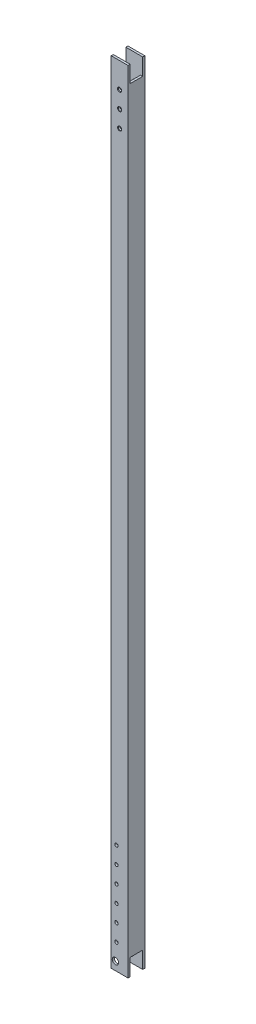
from build123d import *

# Parameters (mm, degrees)
SKETCH1_W                       = 25.4
SKETCH1_H                       = 25.4
SKETCH1_W_2                     = 19.05
SKETCH1_H_2                     = 19.05
BOSS_EXTRUDE1_DEPTH             = 1143
F_10_CLEARANCE_HOLE1_D          = 5.1054
F_10_CLEARANCE_HOLE2_AT_2_COUNT = 2
F_10_CLEARANCE_HOLE2_AT_2_PITCH = 50.8
F_10_CLEARANCE_HOLE2_AT_3_COUNT = 2
F_10_CLEARANCE_HOLE2_AT_3_PITCH = 25.4
SKETCH6_W                       = 25.4
SKETCH6_H                       = 3.175
BOSS_EXTRUDE2_DEPTH             = 25.4
SKETCH7_W                       = 25.4
SKETCH7_H                       = 3.175
BOSS_EXTRUDE3_DEPTH             = 25.4
F_3_8_0_375_DIAMETER_HOLE2_D    = 9.525


with BuildPart() as part:
    # Sketch1 → Boss-Extrude1 (new body)
    with BuildSketch(Plane(origin=(0, 0, 0), x_dir=(1, 0, 0), z_dir=(0, 1, 0))):
        Rectangle(SKETCH1_W, SKETCH1_H)
        Rectangle(SKETCH1_W_2, SKETCH1_H_2, mode=Mode.SUBTRACT)
    extrude(amount=BOSS_EXTRUDE1_DEPTH)

    # #10 Clearance Hole1 (through all)
    with Locations(Plane.XY.offset(12.7)):
        with Locations((-4.7625, 114.3), (-4.7625, 63.5), (-4.7625, 38.1), (-4.7625, 12.7), (-4.7625, 139.7), (-4.7625, 88.9)):
            Hole(F_10_CLEARANCE_HOLE1_D / 2)

    # Sketch5 → #10 Clearance Hole2 (revolve, cut)
    with BuildSketch(Plane(origin=(0, 1130.3, 12.7), x_dir=(0, -1, 0), z_dir=(1, 0, 0))):
        Polygon((0, 0), (0, 25.4), (3.1877, 25.4), (2.5527, 24.765), (2.5527, 0.635), (3.1877, 0), align=None)
    f_10_clearance_hole2 = revolve(axis=Axis((0, 1130.3, 19.05), (0, 0, -1)), mode=Mode.SUBTRACT)

    # #10 Clearance Hole2 at 2: #10 Clearance Hole2 ×2
    with Locations(*[(0, -i * F_10_CLEARANCE_HOLE2_AT_2_PITCH, 0) for i in range(1, F_10_CLEARANCE_HOLE2_AT_2_COUNT)]):
        add(f_10_clearance_hole2, mode=Mode.SUBTRACT)

    # #10 Clearance Hole2 at 3: #10 Clearance Hole2 ×2
    with Locations(*[(0, -i * F_10_CLEARANCE_HOLE2_AT_3_PITCH, 0) for i in range(1, F_10_CLEARANCE_HOLE2_AT_3_COUNT)]):
        add(f_10_clearance_hole2, mode=Mode.SUBTRACT)

    # Sketch6 → Boss-Extrude2 (add)
    with BuildSketch(Plane(origin=(0, 1143, 0), x_dir=(1, 0, 0), z_dir=(0, 1, 0))):
        with Locations((0, 11.1125)):
            Rectangle(SKETCH6_W, SKETCH6_H)
        with Locations((0, -11.1125)):
            Rectangle(SKETCH6_W, SKETCH6_H)
    extrude(amount=BOSS_EXTRUDE2_DEPTH)

    # Sketch7 → Boss-Extrude3 (add)
    with BuildSketch(Plane.XZ):
        with Locations((0, -11.1125)):
            Rectangle(SKETCH7_W, SKETCH7_H)
        with Locations((0, 11.1125)):
            Rectangle(SKETCH7_W, SKETCH7_H)
    extrude(amount=BOSS_EXTRUDE3_DEPTH)

    # 3/8 (0.375) Diameter Hole2 (through all)
    with Locations(Plane.XY.offset(12.7)):
        with Locations((-6.35, -12.7)):
            Hole(F_3_8_0_375_DIAMETER_HOLE2_D / 2)


solid = part.part
